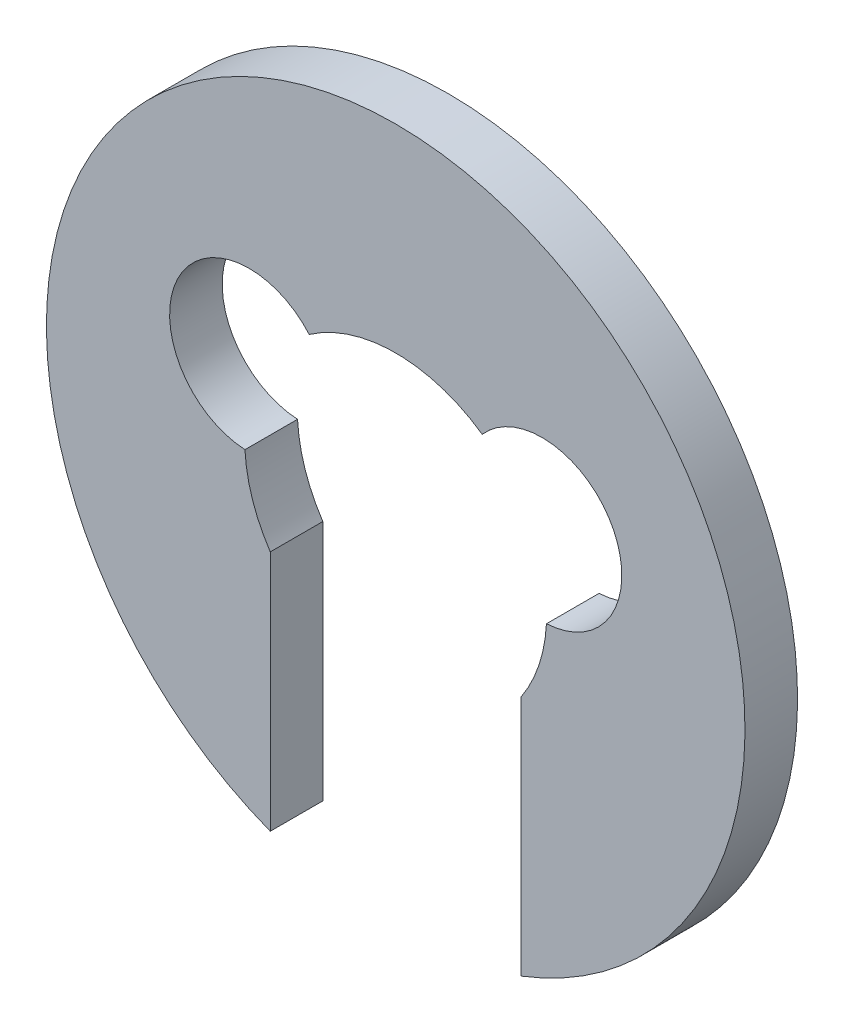
from build123d import *

# Parameters (mm, degrees)
F_01_START                                = 7.48
S01_INSTALLED_SPRING_CLIP_ENVELOPE_R      = 4.65
S01_INSTALLED_SPRING_CLIP_ENVELOPE_R_2    = 2.01
F_01_INSTALLED_SPRING_CLIP_ENVELOPE_DEPTH = 0.7
F_02_START                                = 7.46
S02_RADIAL_ENTRY_OPENING_W                = 3.34
S02_RADIAL_ENTRY_OPENING_H                = 5.1
F_02_RADIAL_ENTRY_OPENING_DEPTH           = 0.75
F_03_START                                = 7.46
S03_LEFT_SPRING_RELIEF_R                  = 1.06
F_03_LEFT_SPRING_RELIEF_DEPTH             = 0.75
F_04_START                                = 7.46
S04_RIGHT_SPRING_RELIEF_R                 = 1.06
F_04_RIGHT_SPRING_RELIEF_DEPTH            = 0.75


with BuildPart() as part:
    # S01 - Installed spring clip envelope → 01 - Installed spring clip envelope (new body)
    with BuildSketch(Plane.XY.offset(F_01_START)):
        Circle(S01_INSTALLED_SPRING_CLIP_ENVELOPE_R)
        Circle(S01_INSTALLED_SPRING_CLIP_ENVELOPE_R_2, mode=Mode.SUBTRACT)
    extrude(amount=F_01_INSTALLED_SPRING_CLIP_ENVELOPE_DEPTH)

    # S02 - Radial entry opening → 02 - Radial entry opening (cut)
    with BuildSketch(Plane.XY.offset(F_02_START)):
        with Locations((0, -2.25)):
            Rectangle(S02_RADIAL_ENTRY_OPENING_W, S02_RADIAL_ENTRY_OPENING_H)
    extrude(amount=F_02_RADIAL_ENTRY_OPENING_DEPTH, mode=Mode.SUBTRACT)

    # S03 - Left spring relief → 03 - Left spring relief (cut)
    with BuildSketch(Plane.XY.offset(F_03_START)):
        with Locations((-1.95, 0.95)):
            Circle(S03_LEFT_SPRING_RELIEF_R)
    extrude(amount=F_03_LEFT_SPRING_RELIEF_DEPTH, mode=Mode.SUBTRACT)

    # S04 - Right spring relief → 04 - Right spring relief (cut)
    with BuildSketch(Plane.XY.offset(F_04_START)):
        with Locations((1.95, 0.95)):
            Circle(S04_RIGHT_SPRING_RELIEF_R)
    extrude(amount=F_04_RIGHT_SPRING_RELIEF_DEPTH, mode=Mode.SUBTRACT)


solid = part.part
